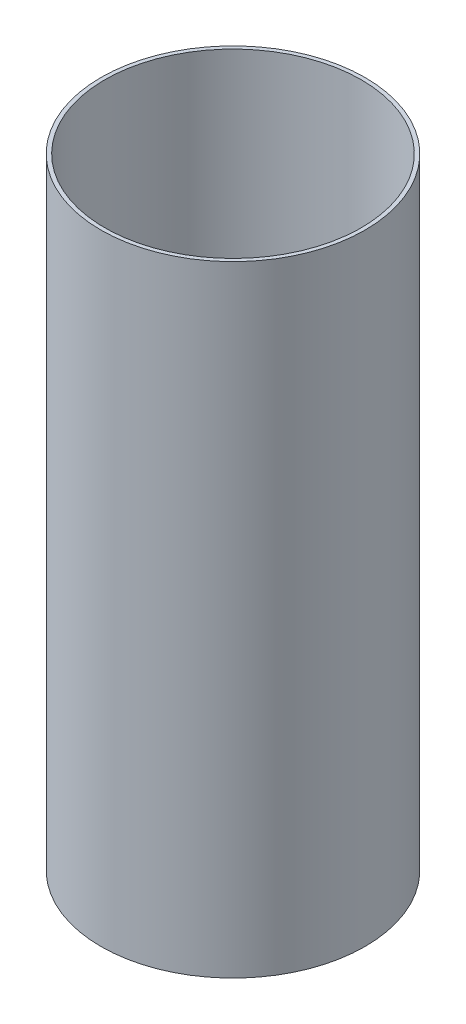
from build123d import *

# Parameters (mm, degrees)
SKETCH1_R           = 32.45
SKETCH1_R_2         = 31.5
BOSS_EXTRUDE1_DEPTH = 152.4


with BuildPart() as part:
    # Sketch1 → Boss-Extrude1 (new body)
    with BuildSketch(Plane(origin=(0, 0, 0), x_dir=(1, 0, 0), z_dir=(0, 1, 0))):
        with Locations(Location((0, 0, 0), (0, 0, 90))):
            Circle(SKETCH1_R)
        with Locations(Location((0, 0, 0), (0, 0, 90))):
            Circle(SKETCH1_R_2, mode=Mode.SUBTRACT)
    extrude(amount=BOSS_EXTRUDE1_DEPTH)


solid = part.part
